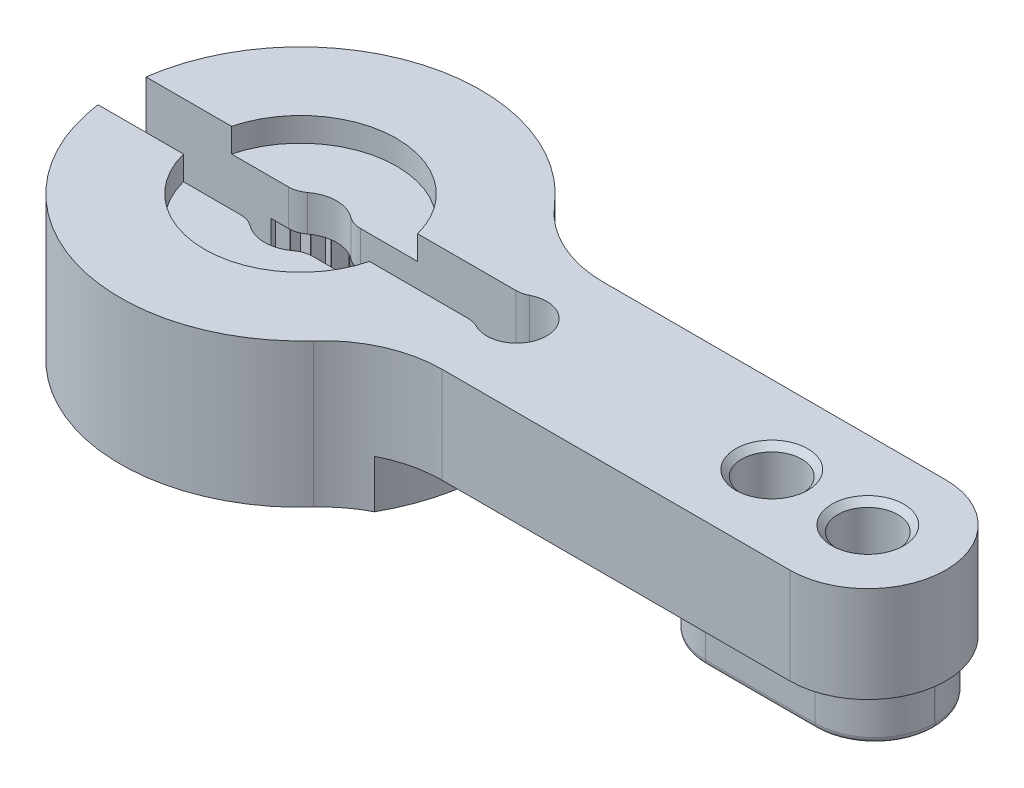
from build123d import *

# Parameters (mm, degrees)
BOSS_EXTRUDE1_DEPTH = 3
SKETCH2_R           = 1.25
CUT_EXTRUDE1_DEPTH  = 16
CHAMFER1_SIZE       = 0.25
SKETCH3_R           = 4
CUT_EXTRUDE2_DEPTH  = 1
CUT_EXTRUDE3_DEPTH  = 11
CUT_EXTRUDE4_DEPTH  = 2
FILLET1_R           = 0.25
CUT_EXTRUDE5_DEPTH  = 3
SKETCH7_R           = 2.35
CUT_EXTRUDE6_DEPTH  = 3.5
CUT_EXTRUDE7_DEPTH  = 3.5
CIRPATTERN1_COUNT   = 24


with BuildPart() as part:
    # Sketch1 → Boss-Extrude1 (new, symmetric)
    with BuildSketch(Plane(origin=(0, 0, 0), x_dir=(1, 0, 0), z_dir=(0, 1, 0))):
        with BuildLine():
            Line((23.75, 3.122009569), (9.501734608, 3.122009569))
            ThreePointArc((9.501734608, 3.122009569), (7.409369814, 3.580863286), (5.701040765, 4.873205742))
            ThreePointArc((5.701040765, 4.873205742), (-7.499303275, 0.102227183), (5.566088347, -5.026794258))
            ThreePointArc((5.566088347, -5.026794258), (7.246540637, -3.808746464), (9.276813911, -3.377990431))
            Line((9.276813911, -3.377990431), (23.75, -3.377990431))
            ThreePointArc((23.75, -3.377990431), (27, -0.127990431), (23.75, 3.122009569))
        make_face()
    extrude(amount=BOSS_EXTRUDE1_DEPTH, both=True)

    # Sketch2 → Cut-Extrude1 (cut)
    with BuildSketch(Plane(origin=(0, 3, 0), x_dir=(1, 0, 0), z_dir=(0, 1, 0))):
        with Locations(Location((23.75, -0.127990431, 0), (0, 0, 270))):
            Circle(SKETCH2_R)
        with Locations(Location((19.75, -0.127990431, 0), (0, 0, 270))):
            Circle(SKETCH2_R)
    extrude(amount=-CUT_EXTRUDE1_DEPTH, mode=Mode.SUBTRACT)

    # Chamfer1
    chamfer1_edges = [part.edges().sort_by_distance(p)[0] for p in [
        (23.75, 3, -1.122009569),
        (19.75, 3, -1.122009569),
    ]]
    chamfer(chamfer1_edges, length=CHAMFER1_SIZE)

    # Sketch3 → Cut-Extrude2 (cut)
    with BuildSketch(Plane(origin=(0, 3, 0), x_dir=(1, 0, 0), z_dir=(0, 1, 0))):
        with Locations(Location((0, 0, 0), (0, 0, 270))):
            Circle(SKETCH3_R)
    extrude(amount=-CUT_EXTRUDE2_DEPTH, mode=Mode.SUBTRACT)

    # Sketch4 → Cut-Extrude3 (cut)
    with BuildSketch(Plane(origin=(0, 3, 0), x_dir=(1, 0, 0), z_dir=(0, 1, 0))):
        with BuildLine():
            Line((-1.5, 1), (-9, 1))
            Line((-9, 1), (-9, -1))
            Line((-9, -1), (-1.5, -1))
            ThreePointArc((-1.5, -1), (-1.183772234, -1.051316702), (-0.9, -1.2))
            ThreePointArc((-0.9, -1.2), (0, -1.5), (0.9, -1.2))
            ThreePointArc((0.9, -1.2), (1.183772234, -1.051316702), (1.5, -1))
            Line((1.5, -1), (7.969223594, -1))
            ThreePointArc((7.969223594, -1), (8.204925854, -1.028174684), (8.427346441, -1.111111111))
            ThreePointArc((8.427346441, -1.111111111), (10.25, 0), (8.427346441, 1.111111111))
            ThreePointArc((8.427346441, 1.111111111), (8.204925854, 1.028174684), (7.969223594, 1))
            Line((7.969223594, 1), (1.5, 1))
            ThreePointArc((1.5, 1), (1.183772234, 1.051316702), (0.9, 1.2))
            ThreePointArc((0.9, 1.2), (0, 1.5), (-0.9, 1.2))
            ThreePointArc((-0.9, 1.2), (-1.183772234, 1.051316702), (-1.5, 1))
        make_face()
    extrude(amount=-CUT_EXTRUDE3_DEPTH, mode=Mode.SUBTRACT)

    # Sketch5 → Cut-Extrude4 (cut)
    with BuildSketch(Plane.XZ.offset(3)):
        with BuildLine():
            Line((24.055684797, -4.372009569), (19.49, -4.372009569))
            Line((19.49, -4.372009569), (6.737511188, -4.372009569))
            ThreePointArc((6.737511188, -4.372009569), (8.030233116, 0.154534121), (6.564314835, 4.627990431))
            Line((6.564314835, 4.627990431), (19.49, 4.627990431))
            Line((19.49, 4.627990431), (24.055684797, 4.627990431))
            ThreePointArc((24.055684797, 4.627990431), (27.230594245, 3.312899878), (28.545684797, 0.137990431))
            Line((28.545684797, 0.137990431), (28.545684797, 0.117990431))
            ThreePointArc((28.545684797, 0.117990431), (27.230594245, -3.056919017), (24.055684797, -4.372009569))
        make_face()
        with BuildLine():
            Line((24.055684797, 2.627990431), (19.49, 2.627990431))
            ThreePointArc((19.49, 2.627990431), (17.729304115, 1.898686316), (17, 0.137990431))
            Line((17, 0.137990431), (17, 0.117990431))
            ThreePointArc((17, 0.117990431), (17.729304115, -1.642705455), (19.49, -2.372009569))
            Line((19.49, -2.372009569), (24.055684797, -2.372009569))
            ThreePointArc((24.055684797, -2.372009569), (25.816380683, -1.642705455), (26.545684797, 0.117990431))
            Line((26.545684797, 0.117990431), (26.545684797, 0.137990431))
            ThreePointArc((26.545684797, 0.137990431), (25.816380683, 1.898686316), (24.055684797, 2.627990431))
        make_face(mode=Mode.SUBTRACT)
    extrude(amount=-CUT_EXTRUDE4_DEPTH, mode=Mode.SUBTRACT)

    # Fillet1
    fillet1_edges = [part.edges().sort_by_distance(p)[0] for p in [
        (25.816380683, -3, -1.642705455),
        (21.772842399, -3, -2.372009569),
        (17.729304115, -3, -1.642705455),
        (17, -3, 0.127990431),
        (17.729304115, -3, 1.898686316),
        (21.772842399, -3, 2.627990431),
        (25.816380683, -3, 1.898686316),
        (26.545684797, -3, 0.127990431),
    ]]
    fillet(fillet1_edges, radius=FILLET1_R)

    # Sketch6 → Cut-Extrude5 (cut)
    with BuildSketch(Plane.XZ.offset(1)):
        with BuildLine():
            Line((16.572326108, 2.507990431), (10.678705054, 2.507990431))
            Line((10.678705054, 2.507990431), (9.432782088, 2.507990431))
            ThreePointArc((9.432782088, 2.507990431), (10.490779488, -0.069105379), (8.754910472, -2.247990431))
            Line((8.754910472, -2.247990431), (10.678705054, -2.247990431))
            Line((10.678705054, -2.247990431), (16.572326108, -2.247990431))
            Line((16.572326108, -2.247990431), (18.365364688, -2.247990431))
            ThreePointArc((18.365364688, -2.247990431), (17.000002911, 0.131991595), (18.3722845, 2.507990431))
            Line((18.3722845, 2.507990431), (16.572326108, 2.507990431))
        make_face()
    extrude(amount=-CUT_EXTRUDE5_DEPTH, mode=Mode.SUBTRACT)

    # Sketch7 → Cut-Extrude6 (cut)
    with BuildSketch(Plane.XZ.offset(3)):
        Circle(SKETCH7_R)
    extrude(amount=-CUT_EXTRUDE6_DEPTH, mode=Mode.SUBTRACT)

    # Sketch8 → Cut-Extrude7 (cut)
    with BuildSketch(Plane.XZ.offset(3)):
        with BuildLine():
            ThreePointArc((-0.299151371, 2.330881476), (0, 2.35), (0.299151371, 2.330881476))
            Line((0.299151371, 2.330881476), (0, 2.84902685))
            Line((0, 2.84902685), (-0.299151371, 2.330881476))
        make_face()
    cut_extrude7 = extrude(amount=-CUT_EXTRUDE7_DEPTH, mode=Mode.SUBTRACT)

    # CirPattern1: Cut-Extrude7 ×24 about axis
    cirpattern1_axis = Axis((0, 0, 0), (0, 1, 0))
    for i in range(1, CIRPATTERN1_COUNT):
        add(cut_extrude7.rotate(cirpattern1_axis, i * 360 / CIRPATTERN1_COUNT), mode=Mode.SUBTRACT)


solid = part.part
